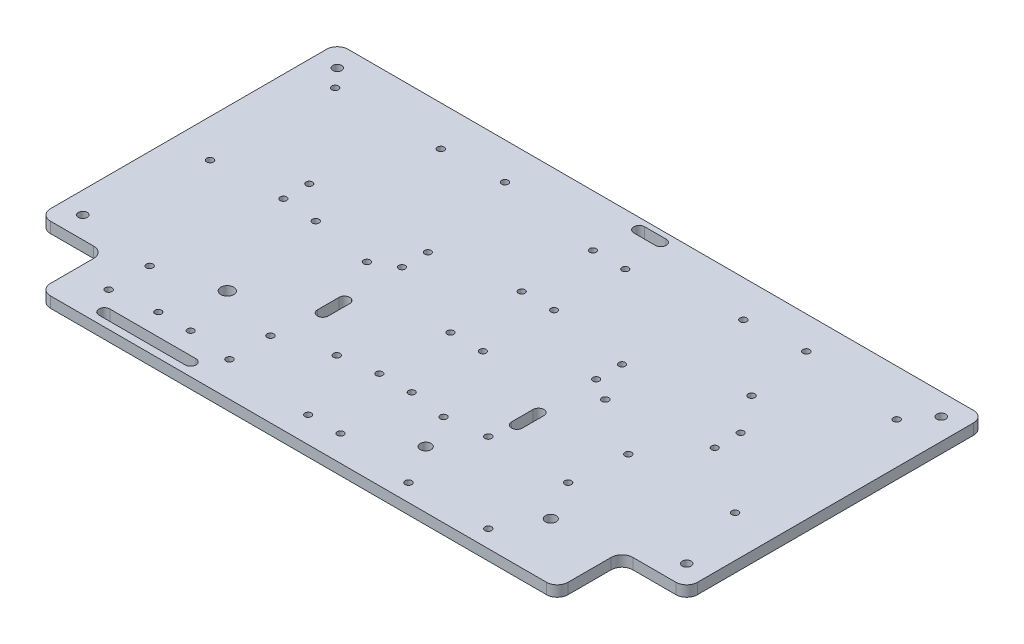
from build123d import *

# Parameters (mm, degrees)
ESQUISSE1_R             = 2.05
ESQUISSE1_R_2           = 1.55
ESQUISSE1_R_3           = 2.5
ESQUISSE1_R_4           = 3
BOSS_EXTRU_1_DEPTH      = 5
CONG_2_R                = 5
ESQUISSE2_R             = 1.5
ENL_V_MAT_EXTRU_1_DEPTH = 10


with BuildPart() as part:
    # Esquisse1 → Boss.-Extru.1 (new body)
    with BuildSketch(Plane(origin=(0, 0, 0), x_dir=(1, 0, 0), z_dir=(0, 1, 0))):
        Polygon((150, -69), (150, 69), (-149.848840409, 69), (-150, 69), (-150, -69), (-120, -69), (-120, -99), (120, -99), (120, -69), align=None)
        with Locations(Location((-140, 59, 0), (0, 0, 270))):
            Circle(ESQUISSE1_R, mode=Mode.SUBTRACT)
        with Locations(Location((140, 59, 0), (0, 0, 90))):
            Circle(ESQUISSE1_R, mode=Mode.SUBTRACT)
        with Locations(Location((140, -59, 0), (0, 0, 270))):
            Circle(ESQUISSE1_R, mode=Mode.SUBTRACT)
        with Locations(Location((-140, -59, 0), (0, 0, 90))):
            Circle(ESQUISSE1_R, mode=Mode.SUBTRACT)
        with Locations(Location((-48, -83, 0), (0, 0, 270))):
            Circle(ESQUISSE1_R_2, mode=Mode.SUBTRACT)
        with Locations(Location((-104, -83, 0), (0, 0, 270))):
            Circle(ESQUISSE1_R_2, mode=Mode.SUBTRACT)
        with Locations(Location((-48, -64, 0), (0, 0, 270))):
            Circle(ESQUISSE1_R_2, mode=Mode.SUBTRACT)
        with Locations(Location((-104, -64, 0), (0, 0, 270))):
            Circle(ESQUISSE1_R_2, mode=Mode.SUBTRACT)
        with Locations(Location((82.54, -28.63, 0), (0, 0, 270))):
            Circle(ESQUISSE1_R_2, mode=Mode.SUBTRACT)
        with Locations(Location((130.8, -27.36, 0), (0, 0, 270))):
            Circle(ESQUISSE1_R_2, mode=Mode.SUBTRACT)
        with Locations(Location((130.8, 47.57, 0), (0, 0, 270))):
            Circle(ESQUISSE1_R_2, mode=Mode.SUBTRACT)
        with Locations(Location((82.54, 53.92, 0), (0, 0, 270))):
            Circle(ESQUISSE1_R_2, mode=Mode.SUBTRACT)
        with Locations(Location((87.62, 23.44, 0), (0, 0, 270))):
            Circle(ESQUISSE1_R_2, mode=Mode.SUBTRACT)
        with Locations(Location((43, -54, 0), (0, 0, 270))):
            Circle(ESQUISSE1_R_2, mode=Mode.SUBTRACT)
        with Locations(Location((80, -54, 0), (0, 0, 270))):
            Circle(ESQUISSE1_R_2, mode=Mode.SUBTRACT)
        with Locations(Location((80, -91, 0), (0, 0, 270))):
            Circle(ESQUISSE1_R_2, mode=Mode.SUBTRACT)
        with Locations(Location((43, -91, 0), (0, 0, 270))):
            Circle(ESQUISSE1_R_2, mode=Mode.SUBTRACT)
        with Locations(Location((-132.5, 50.5, 0), (0, 0, 270))):
            Circle(ESQUISSE1_R_2, mode=Mode.SUBTRACT)
        with Locations(Location((-132.5, -7.5, 0), (0, 0, 270))):
            Circle(ESQUISSE1_R_2, mode=Mode.SUBTRACT)
        with Locations(Location((-83.5, -7.5, 0), (0, 0, 270))):
            Circle(ESQUISSE1_R_2, mode=Mode.SUBTRACT)
        with Locations(Location((-83.5, 50.5, 0), (0, 0, 270))):
            Circle(ESQUISSE1_R_2, mode=Mode.SUBTRACT)
        with Locations(Location((-55.25, 52, 0), (0, 0, 270))):
            Circle(ESQUISSE1_R_2, mode=Mode.SUBTRACT)
        with Locations(Location((-55.25, -12, 0), (0, 0, 270))):
            Circle(ESQUISSE1_R_2, mode=Mode.SUBTRACT)
        with Locations(Location((55.25, 52, 0), (0, 0, 270))):
            Circle(ESQUISSE1_R_2, mode=Mode.SUBTRACT)
        with Locations(Location((55.25, -12, 0), (0, 0, 270))):
            Circle(ESQUISSE1_R_2, mode=Mode.SUBTRACT)
        with Locations(Location((-24.75, -56.5, 0), (0, 0, 270))):
            Circle(ESQUISSE1_R_2, mode=Mode.SUBTRACT)
        with Locations(Location((24.75, -56.5, 0), (0, 0, 270))):
            Circle(ESQUISSE1_R_2, mode=Mode.SUBTRACT)
        with Locations(Location((32.5, -72.5, 0), (0, 0, 270))):
            Circle(ESQUISSE1_R_3, mode=Mode.SUBTRACT)
        with Locations(Location((90.5, -72.5, 0), (0, 0, 270))):
            Circle(ESQUISSE1_R_3, mode=Mode.SUBTRACT)
        with Locations(Location((-76, -56, 0), (0, 0, 270))):
            Circle(ESQUISSE1_R_4, mode=Mode.SUBTRACT)
        with BuildLine():
            Line((-56, -95.5), (-96, -95.5))
            ThreePointArc((-96, -95.5), (-98.5, -93), (-96, -90.5))
            Line((-96, -90.5), (-56, -90.5))
            ThreePointArc((-56, -90.5), (-53.5, -93), (-56, -95.5))
        make_face(mode=Mode.SUBTRACT)
        with BuildLine():
            Line((-5, 66.5), (5, 66.5))
            ThreePointArc((5, 66.5), (7.5, 64), (5, 61.5))
            Line((5, 61.5), (-5, 61.5))
            ThreePointArc((-5, 61.5), (-7.5, 64), (-5, 66.5))
        make_face(mode=Mode.SUBTRACT)
        with BuildLine():
            Line((-42.5, -32.709135822), (-42.5, -42.709135822))
            ThreePointArc((-42.5, -42.709135822), (-45, -45.209135822), (-47.5, -42.709135822))
            Line((-47.5, -42.709135822), (-47.5, -32.709135822))
            ThreePointArc((-47.5, -32.709135822), (-45, -30.209135822), (-42.5, -32.709135822))
        make_face(mode=Mode.SUBTRACT)
        with BuildLine():
            Line((42.5, -32.709135822), (42.5, -42.709135822))
            ThreePointArc((42.5, -42.709135822), (45, -45.209135822), (47.5, -42.709135822))
            Line((47.5, -42.709135822), (47.5, -32.709135822))
            ThreePointArc((47.5, -32.709135822), (45, -30.209135822), (42.5, -32.709135822))
        make_face(mode=Mode.SUBTRACT)
    extrude(amount=BOSS_EXTRU_1_DEPTH)

    # Congé2
    cong_2_edges = [part.edges().sort_by_distance(p)[0] for p in [
        (150, 2.5, -69),
        (150, 2.5, 69),
        (120, 2.5, 69),
        (120, 2.5, 99),
        (-120, 2.5, 99),
        (-120, 2.5, 69),
        (-150, 2.5, 69),
        (-150, 2.5, -69),
    ]]
    fillet(cong_2_edges, radius=CONG_2_R)

    # Esquisse2 → Enlèv. mat.-Extru.1 (cut)
    with BuildSketch(Plane(origin=(0, 5, 0), x_dir=(1, 0, 0), z_dir=(0, 1, 0))):
        with Locations(Location((-7.5, 45, 0), (0, 0, 270))):
            Circle(ESQUISSE2_R)
        with Locations(Location((7.5, 45, 0), (0, 0, 90))):
            Circle(ESQUISSE2_R)
        with Locations(Location((-7.5, 12, 0), (0, 0, 270))):
            Circle(ESQUISSE2_R)
        with Locations(Location((7.5, 12, 0), (0, 0, 90))):
            Circle(ESQUISSE2_R)
        with Locations(Location((-7.5, -21, 0), (0, 0, 270))):
            Circle(ESQUISSE2_R)
        with Locations(Location((7.5, -21, 0), (0, 0, 90))):
            Circle(ESQUISSE2_R)
        with Locations(Location((-7.5, -54, 0), (0, 0, 270))):
            Circle(ESQUISSE2_R)
        with Locations(Location((7.5, -54, 0), (0, 0, 90))):
            Circle(ESQUISSE2_R)
        with Locations(Location((-7.5, -87, 0), (0, 0, 270))):
            Circle(ESQUISSE2_R)
        with Locations(Location((7.5, -87, 0), (0, 0, 90))):
            Circle(ESQUISSE2_R)
        with Locations(Location((-100, 6, 0), (0, 0, 270))):
            Circle(ESQUISSE2_R)
        with Locations(Location((-100, -6, 0), (0, 0, 90))):
            Circle(ESQUISSE2_R)
        with Locations(Location((100, -6, 0), (0, 0, 270))):
            Circle(ESQUISSE2_R)
        with Locations(Location((100, 6, 0), (0, 0, 90))):
            Circle(ESQUISSE2_R)
        with Locations(Location((-83.5, -80.5, 0), (0, 0, 270))):
            Circle(ESQUISSE2_R)
        with Locations(Location((-68.5, -80.5, 0), (0, 0, 90))):
            Circle(ESQUISSE2_R)
        with Locations(Location((-45, -6, 0), (0, 0, 90))):
            Circle(ESQUISSE2_R)
        with Locations(Location((-45, 6, 0), (0, 0, 270))):
            Circle(ESQUISSE2_R)
        with Locations(Location((45, 6, 0), (0, 0, 90))):
            Circle(ESQUISSE2_R)
        with Locations(Location((45, -6, 0), (0, 0, 270))):
            Circle(ESQUISSE2_R)
    extrude(amount=-ENL_V_MAT_EXTRU_1_DEPTH, mode=Mode.SUBTRACT)


solid = part.part
